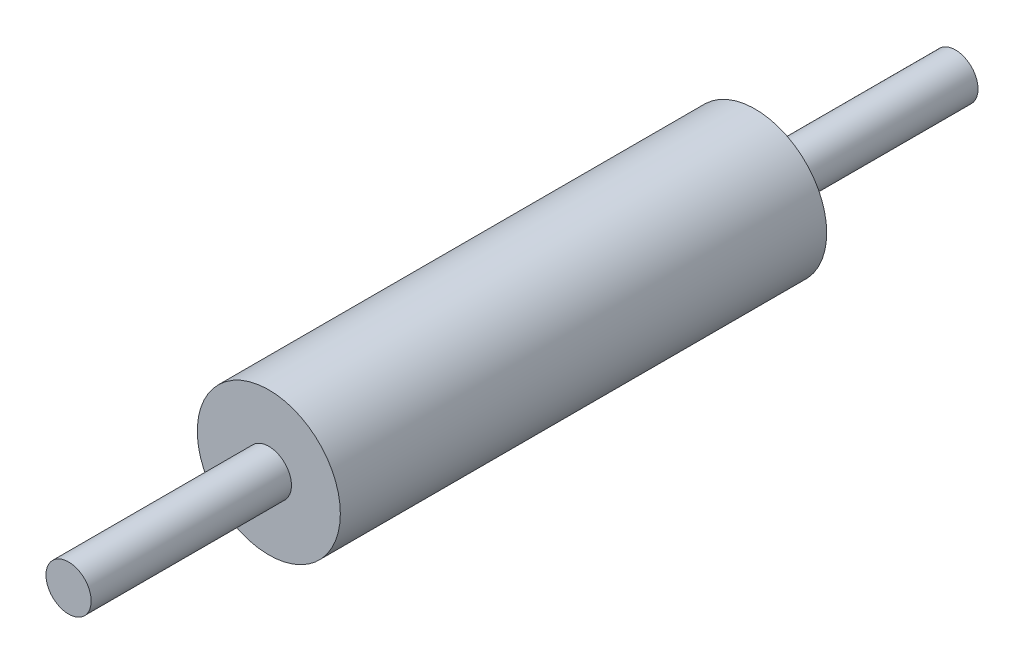
from build123d import *

# Parameters (mm, degrees)
SKETCH1_R           = 12.5
BOSS_EXTRUDE1_DEPTH = 85
SKETCH2_R           = 3.95
BOSS_EXTRUDE2_DEPTH = 35
BOSS_EXTRUDE3_START = 35
SKETCH3_R           = 3.95
BOSS_EXTRUDE3_DEPTH = 35


with BuildPart() as part:
    # Sketch1 → Boss-Extrude1 (new body)
    with BuildSketch(Plane.XY):
        Circle(SKETCH1_R)
    extrude(amount=-BOSS_EXTRUDE1_DEPTH)

    # Sketch2 → Boss-Extrude2 (add)
    with BuildSketch(Plane.XY):
        Circle(SKETCH2_R)
    extrude(amount=BOSS_EXTRUDE2_DEPTH)

    # Sketch3 → Boss-Extrude3 (add)
    with BuildSketch(Plane(origin=(0, 0, -85), x_dir=(-1, 0, 0), z_dir=(0, 0, -1)).offset(BOSS_EXTRUDE3_START)):
        with Locations(Location((0, 0, 0), (0, 0, 180))):
            Circle(SKETCH3_R)
    extrude(amount=-BOSS_EXTRUDE3_DEPTH)


solid = part.part
